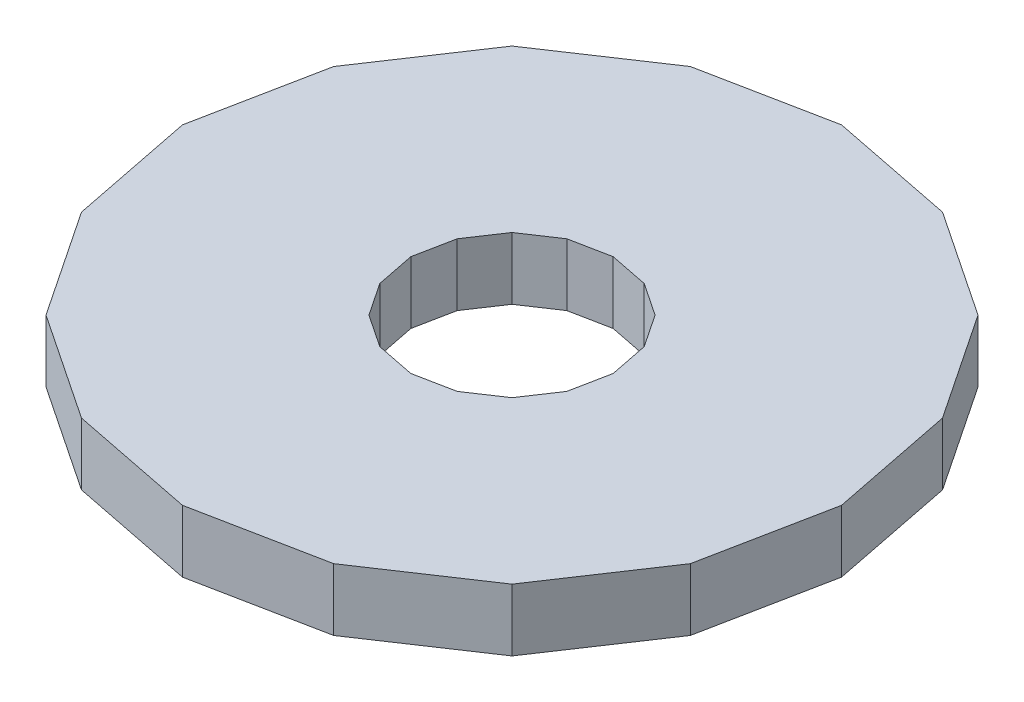
from build123d import *

# Parameters (mm, degrees)
BOSS_EXTRUDE1_DEPTH = 19.05


with BuildPart() as part:
    # Sketch1 → Boss-Extrude1 (new body)
    with BuildSketch(Plane(origin=(0, 0, 0), x_dir=(1, 0, 0), z_dir=(0, 1, 0))):
        Polygon((100.901981178, 0), (93.2212752, 38.613516489), (71.348475126, 71.348475126), (38.613516489, 93.2212752), (0, 100.901981178), (-38.613516489, 93.2212752), (-71.348475126, 71.348475126), (-93.2212752, 38.613516489), (-100.901981178, 0), (-93.2212752, -38.613516489), (-71.348475126, -71.348475126), (-38.613516489, -93.2212752), (0, -100.901981178), (38.613516489, -93.2212752), (71.348475126, -71.348475126), (93.2212752, -38.613516489), align=None)
        Polygon((30.978419548, 0), (28.62032777, 11.854927922), (21.905050533, 21.905050533), (11.854927922, 28.62032777), (0, 30.978419548), (-11.854927922, 28.62032777), (-21.905050533, 21.905050533), (-28.62032777, 11.854927922), (-30.978419548, 0), (-28.62032777, -11.854927922), (-21.905050533, -21.905050533), (-11.854927922, -28.62032777), (0, -30.978419548), (11.854927922, -28.62032777), (21.905050533, -21.905050533), (28.62032777, -11.854927922), align=None, mode=Mode.SUBTRACT)
    extrude(amount=BOSS_EXTRUDE1_DEPTH)


solid = part.part
